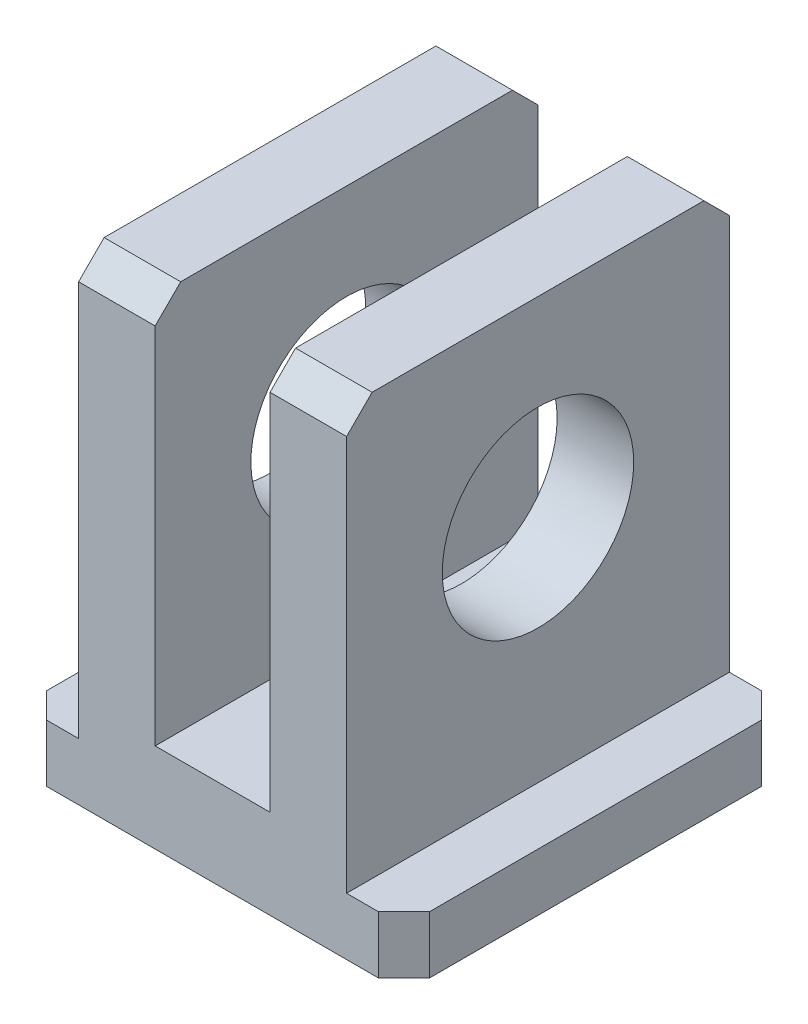
from build123d import *

# Parameters (mm, degrees)
EXTRUDE_1_DEPTH     = 4.5
EXTRUDE_2_DEPTH     = 30
SKETCH_3_W          = 4.5
SKETCH_3_H          = 33
SKETCH_3_W_2        = 9
SKETCH_3_H_2        = 30.5
CUT_EXTRUDE_1_DEPTH = 30
SKETCH_4_R          = 7.5
CUT_EXTRUDE_2_DEPTH = 30


with BuildPart() as part:
    # 草图1 → 凸台-拉伸1 (new body)
    with BuildSketch(Plane(origin=(0, 0, 0), x_dir=(1, 0, 0), z_dir=(0, 1, 0))):
        Polygon((-15, 13), (-13, 15), (13, 15), (15, 13), (15, -13), (13, -15), (-13, -15), (-15, -13), align=None)
    extrude(amount=EXTRUDE_1_DEPTH)

    # 草图2 → 凸台-拉伸2 (add)
    with BuildSketch(Plane(origin=(15, 0, 0), x_dir=(0, 0, -1), z_dir=(1, 0, 0))):
        Polygon((-15, 4.5), (-15, 35.5), (-13, 37.5), (13, 37.5), (15, 35.5), (15, 4.5), align=None)
    extrude(amount=-EXTRUDE_2_DEPTH)

    # 草图3 → 切除-拉伸1 (cut)
    with BuildSketch(Plane.XY.offset(15)):
        with Locations((-12.75, 21)):
            Rectangle(SKETCH_3_W, SKETCH_3_H)
        with Locations((12.75, 21)):
            Rectangle(SKETCH_3_W, SKETCH_3_H)
        with Locations((0, 22.25)):
            Rectangle(SKETCH_3_W_2, SKETCH_3_H_2)
    extrude(amount=-CUT_EXTRUDE_1_DEPTH, mode=Mode.SUBTRACT)

    # 草图4 → 切除-拉伸2 (cut)
    with BuildSketch(Plane(origin=(10.5, 0, 0), x_dir=(0, 0, -1), z_dir=(1, 0, 0))):
        with Locations((0, 22.5)):
            Circle(SKETCH_4_R)
    extrude(amount=-CUT_EXTRUDE_2_DEPTH, mode=Mode.SUBTRACT)


solid = part.part
